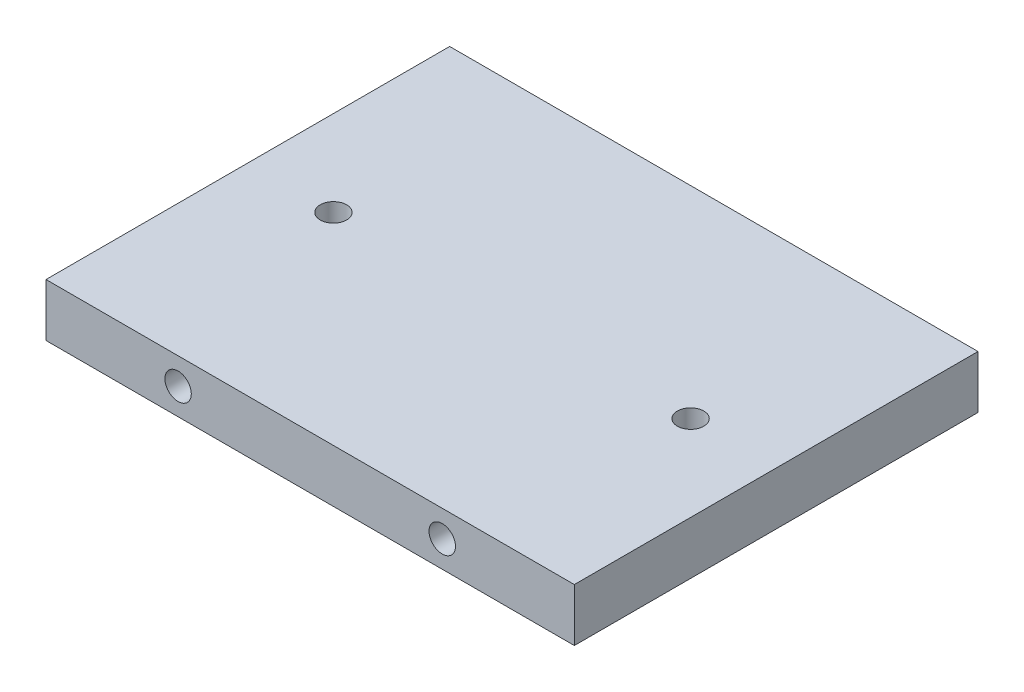
from build123d import *

# Parameters (mm, degrees)
SKETCH1_R           = 3.175
BOSS_EXTRUDE1_DEPTH = 12.7
SKETCH3_R           = 3.175
CUT_EXTRUDE1_DEPTH  = 117.653215918


with BuildPart() as part:
    # Sketch1 → Boss-Extrude1 (new body)
    with BuildSketch(Plane(origin=(0, 0, 0), x_dir=(1, 0, 0), z_dir=(0, 1, 0))):
        Polygon((0, 97.028), (63.5, 97.028), (63.5, 0), (-63.5, 0), (-63.5, 97.028), align=None)
        with Locations(Location((-42.926, 48.514, 0), (0, 0, 270))):
            Circle(SKETCH1_R, mode=Mode.SUBTRACT)
        with Locations(Location((42.926, 48.514, 0), (0, 0, 270))):
            Circle(SKETCH1_R, mode=Mode.SUBTRACT)
    extrude(amount=BOSS_EXTRUDE1_DEPTH)

    # Sketch3 → Cut-Extrude1 (cut, through all)
    with BuildSketch(Plane.XY):
        with Locations((-31.75, 6.35)):
            Circle(SKETCH3_R)
        with Locations((31.75, 6.35)):
            Circle(SKETCH3_R)
    extrude(amount=-CUT_EXTRUDE1_DEPTH, mode=Mode.SUBTRACT)


solid = part.part
